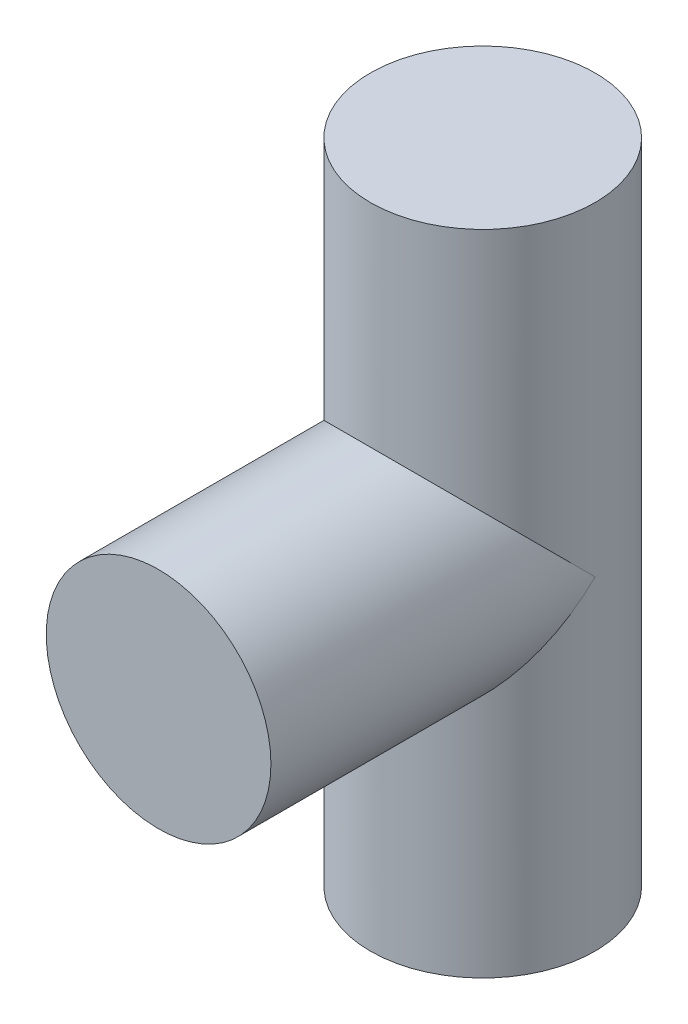
from build123d import *

# Parameters (mm, degrees)
BOSS_EXTRUDE1_DEPTH      = 36.068
BOSS_EXTRUDE1_DEPTH_BACK = 36.068
SKETCH1_R                = 12.5
SKETCH2_R                = 12.5
BOSS_EXTRUDE2_DEPTH      = 36.068


with BuildPart() as part:
    # Sketch1 → Boss-Extrude1 (new, two sides: drawn at the far end of the back side and taken through both)
    with BuildSketch(Plane(origin=(0, 0, 0), x_dir=(1, 0, 0), z_dir=(0, 1, 0)).offset(-BOSS_EXTRUDE1_DEPTH_BACK)):
        Circle(SKETCH1_R)
    extrude(amount=BOSS_EXTRUDE1_DEPTH + BOSS_EXTRUDE1_DEPTH_BACK)

    # Sketch2 → Boss-Extrude2 (add)
    with BuildSketch(Plane.XY):
        Circle(SKETCH2_R)
    extrude(amount=BOSS_EXTRUDE2_DEPTH)


solid = part.part
